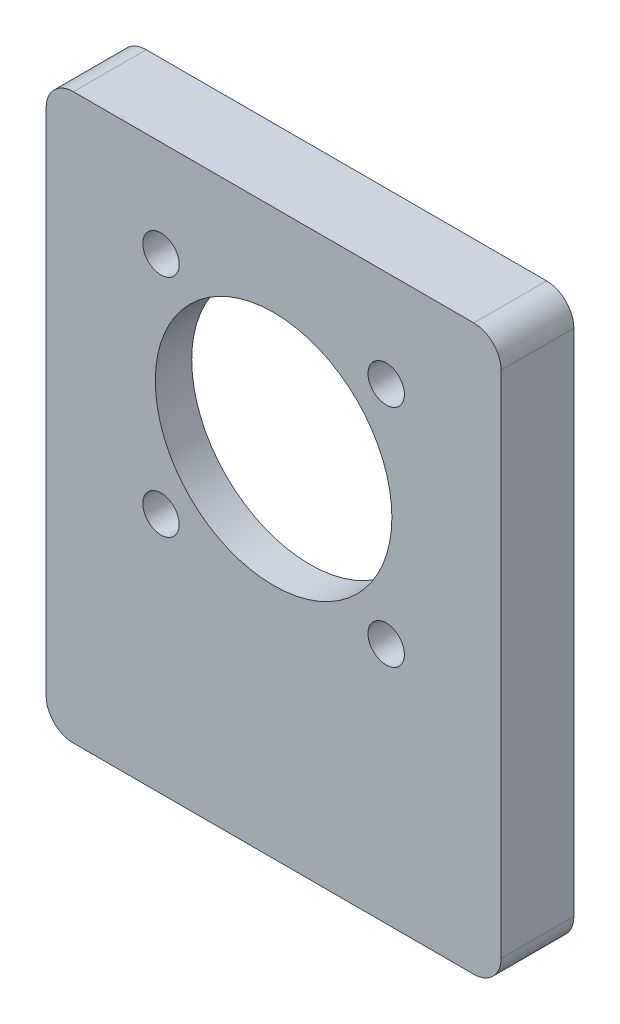
from build123d import *

# Parameters (mm, degrees)
SKETCH_1_W                   = 50
SKETCH_1_H                   = 62
EXTRUDE_1_DEPTH              = 8
SKETCH_2_R                   = 13
SKETCH_2_R_2                 = 2
CUT_EXTRUDE_1_DEPTH          = 41.620192023
HOLE_WIZARD_M5_1_D           = 4.2
HOLE_WIZARD_M5_1_DEPTH       = 15
HOLE_WIZARD_M5_1_CSINK_D     = 5.05
HOLE_WIZARD_M5_1_CSINK_ANGLE = 90
HOLE_WIZARD_M5_1_TIP         = 1.2618073
FILLET_1_R                   = 3
SKETCH_6_R                   = 21.25
CUT_EXTRUDE_2_DEPTH          = 4
CHAMFER_1_SIZE               = 0.5


with BuildPart() as part:
    # 草图1 → 凸台-拉伸1 (new body)
    with BuildSketch(Plane.XY):
        Rectangle(SKETCH_1_W, SKETCH_1_H)
    extrude(amount=EXTRUDE_1_DEPTH)

    # 草图2 → 切除-拉伸1 (cut, through all)
    with BuildSketch(Plane.XY.offset(8)):
        with Locations((0, 8)):
            Circle(SKETCH_2_R)
        with Locations((12.374368671, 20.374368671)):
            Circle(SKETCH_2_R_2)
        with Locations((12.374368671, -4.374368671)):
            Circle(SKETCH_2_R_2)
        with Locations((-12.374368671, -4.374368671)):
            Circle(SKETCH_2_R_2)
        with Locations((-12.374368671, 20.374368671)):
            Circle(SKETCH_2_R_2)
    extrude(amount=-CUT_EXTRUDE_1_DEPTH, mode=Mode.SUBTRACT)

    # M5 螺纹孔1
    with Locations(Plane(origin=(-15, -31, 4), x_dir=(0, 0, -1), z_dir=(0, -1, 0))):
        with Locations((0, 0), (0, 30)):
            CounterSinkHole(HOLE_WIZARD_M5_1_D / 2, HOLE_WIZARD_M5_1_CSINK_D / 2, depth=HOLE_WIZARD_M5_1_DEPTH, counter_sink_angle=HOLE_WIZARD_M5_1_CSINK_ANGLE)
            with Locations((0, 0, -(HOLE_WIZARD_M5_1_DEPTH + HOLE_WIZARD_M5_1_TIP / 2))):  # 118° drill point
                Cone(0, HOLE_WIZARD_M5_1_D / 2, HOLE_WIZARD_M5_1_TIP, mode=Mode.SUBTRACT)

    # 圆角1
    fillet_1_edges = [part.edges().sort_by_distance(p)[0] for p in [
        (25, -31, 4),
        (-25, -31, 4),
        (-25, 31, 4),
        (25, 31, 4),
    ]]
    fillet(fillet_1_edges, radius=FILLET_1_R)

    # 草图6 → 切除-拉伸2 (cut)
    with BuildSketch(Plane(origin=(0, 0, 0), x_dir=(-1, 0, 0), z_dir=(0, 0, -1))):
        with Locations((0, 8)):
            Circle(SKETCH_6_R)
    extrude(amount=-CUT_EXTRUDE_2_DEPTH, mode=Mode.SUBTRACT)

    # 倒角1
    chamfer_1_edges = [part.edges().sort_by_distance(p)[0] for p in [
        (21.25, 8, 0),
    ]]
    chamfer(chamfer_1_edges, length=CHAMFER_1_SIZE)


solid = part.part
